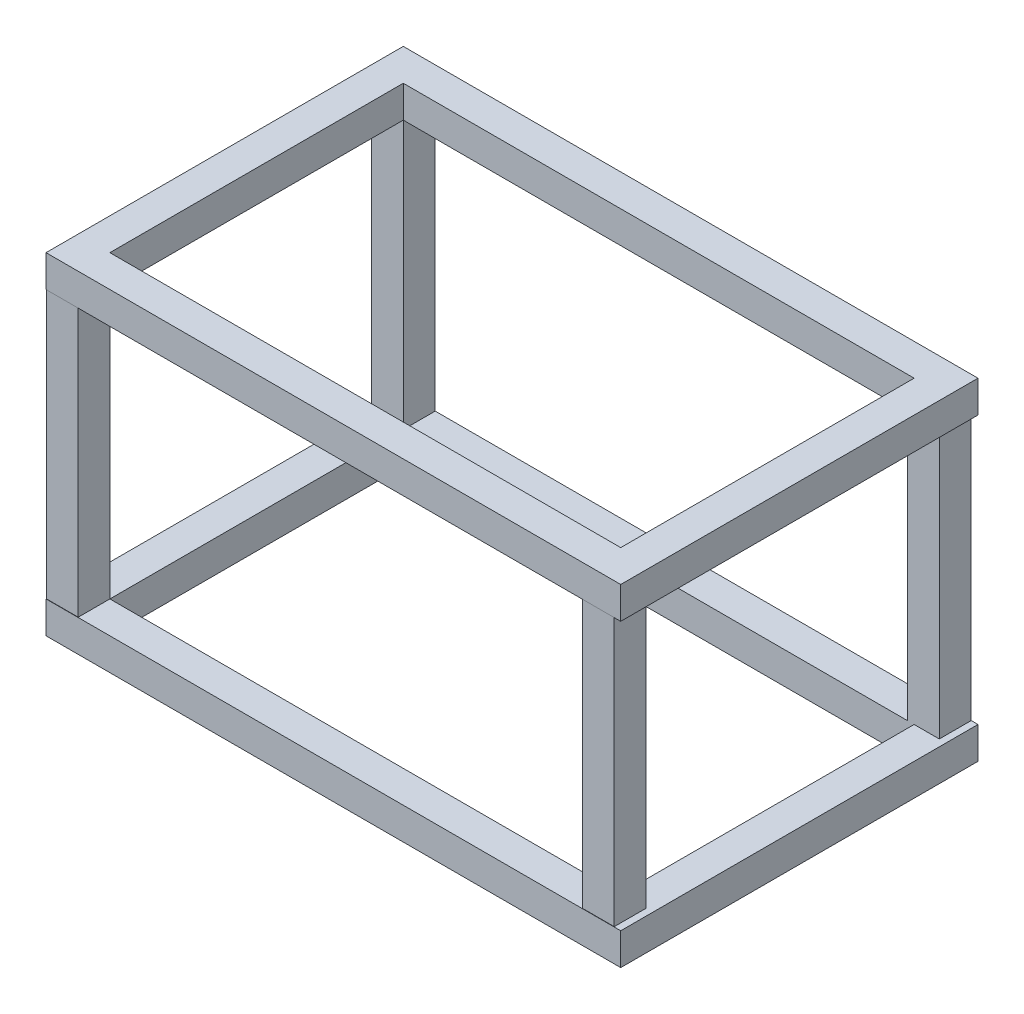
from build123d import *

# Parameters (mm, degrees)
SKETCH1_W            = 406.4
SKETCH1_H            = 233.426
SKETCH1_W_2          = 25.4
SKETCH1_H_2          = 25.4
BOSS_EXTRUDE1_DEPTH  = 25.4
LPATTERN2_COUNT      = 2
LPATTERN2_PITCH      = 238.572
SKETCH2_W            = 25.4
SKETCH2_H            = 25.4
BOSS_EXTRUDE2_DEPTH  = 213.172
LPATTERN4_COUNT      = 2
LPATTERN4_PITCH      = 426.4
LPATTERN4_COUNT_DIR2 = 2
LPATTERN4_PITCH_DIR2 = 258.572


with BuildPart() as part:
    # Sketch1 → Boss-Extrude1 (new body)
    # profile 1 of 2: a face of its own
    with BuildSketch(Plane(origin=(0, 0, 0), x_dir=(1, 0, 0), z_dir=(0, 1, 0))):
        Polygon((-203.2, 142.113), (-203.2, 116.713), (-228.6, 116.713), (-228.6, -142.113), (228.6, -142.113), (228.6, 142.113), align=None)
        Rectangle(SKETCH1_W, SKETCH1_H, mode=Mode.SUBTRACT)
    # profile 2 of 2: a face of its own
    with BuildSketch(Plane(origin=(0, 0, 0), x_dir=(1, 0, 0), z_dir=(0, 1, 0))):
        with Locations((-215.9, 129.413)):
            Rectangle(SKETCH1_W_2, SKETCH1_H_2)
    extrude(amount=BOSS_EXTRUDE1_DEPTH)


with BuildPart() as lpattern2_1:
    # LPattern2: pattern copy
    add(part.part.moved(Location(Vector(0, 1, 0) * (1 * LPATTERN2_PITCH))))


with BuildPart() as part_1:
    add(part.part)

    add(lpattern2_1.part)  # Boss-Extrude2 merges LPattern2_1
    # Sketch2 → Boss-Extrude2 (add)
    with BuildSketch(Plane(origin=(0, 25.4, 0), x_dir=(1, 0, 0), z_dir=(0, 1, 0))):
        with Locations((-215.9, 129.413)):
            Rectangle(SKETCH2_W, SKETCH2_H)
    boss_extrude2 = extrude(amount=BOSS_EXTRUDE2_DEPTH)

    # LPattern4: Boss-Extrude2 2 × 2
    with Locations(*[(i * LPATTERN4_PITCH, 0, j * LPATTERN4_PITCH_DIR2) for i in range(LPATTERN4_COUNT) for j in range(LPATTERN4_COUNT_DIR2) if (i, j) != (0, 0)]):
        add(boss_extrude2)


solid = part_1.part
